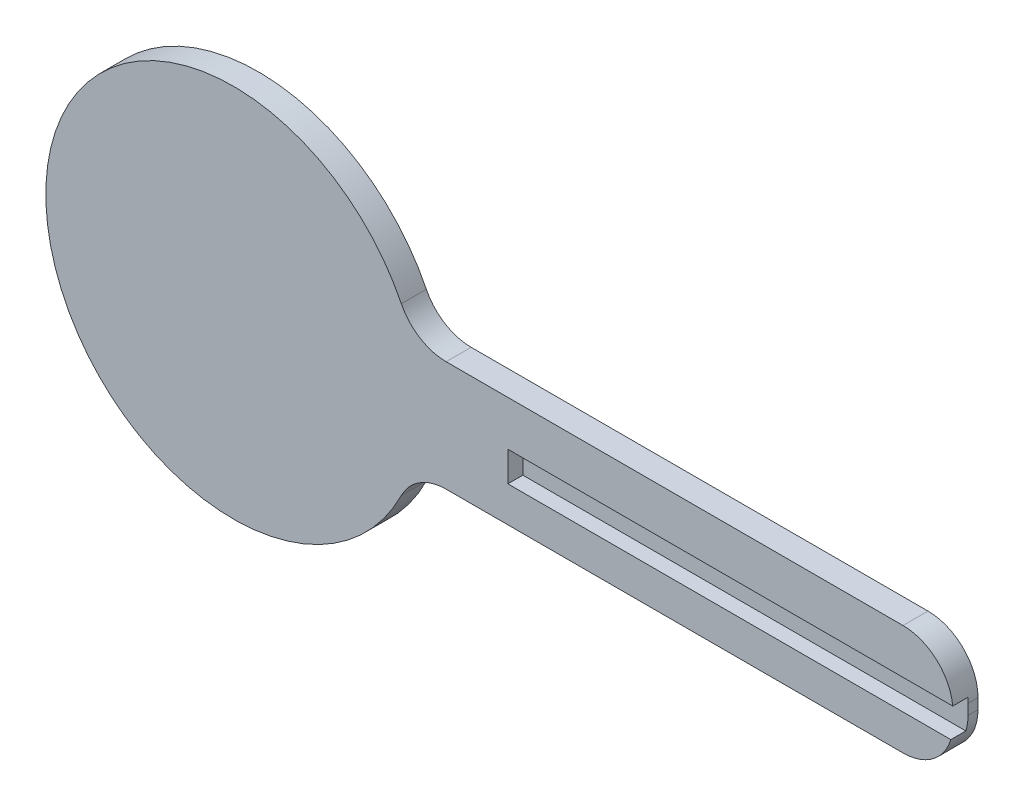
from build123d import *

# Parameters (mm, degrees)
BOSS_EXTRUDE1_DEPTH = 10
SKETCH2_W           = 168.929390661
SKETCH2_H           = 12
CUT_EXTRUDE1_DEPTH  = 6
SKETCH3_W           = 79.959911579
SKETCH3_H           = 12
CUT_EXTRUDE2_DEPTH  = 6


with BuildPart() as part:
    # Sketch1 → Boss-Extrude1 (new body)
    with BuildSketch(Plane.XY):
        with BuildLine():
            Line((85.170110947, 22.083871035), (267.939703111, 22.083871035))
            ThreePointArc((267.939703111, 22.083871035), (282.081838735, 16.226006659), (287.939703111, 2.083871035))
            Line((287.939703111, 2.083871035), (287.939703111, -2.083871035))
            ThreePointArc((287.939703111, -2.083871035), (282.081838735, -16.226006659), (267.939703111, -22.083871035))
            Line((267.939703111, -22.083871035), (85.170110947, -22.083871035))
            ThreePointArc((85.170110947, -22.083871035), (74.615378512, -25.095709768), (67.239561274, -33.224108712))
            ThreePointArc((67.239561274, -33.224108712), (-75, 0), (67.239561274, 33.224108712))
            ThreePointArc((67.239561274, 33.224108712), (74.615378512, 25.095709768), (85.170110947, 22.083871035))
        make_face()
    extrude(amount=BOSS_EXTRUDE1_DEPTH)

    # Sketch2 → Cut-Extrude1 (cut)
    with BuildSketch(Plane.XY.offset(10)):
        with Locations((194.3131347, -1.883371564)):
            Rectangle(SKETCH2_W, SKETCH2_H)
    extrude(amount=-CUT_EXTRUDE1_DEPTH, mode=Mode.SUBTRACT)

    # Sketch3 → Cut-Extrude2 (cut)
    with BuildSketch(Plane.XY.offset(10)):
        with Locations((318.757785819, -1.883371564)):
            Rectangle(SKETCH3_W, SKETCH3_H)
    extrude(amount=-CUT_EXTRUDE2_DEPTH, mode=Mode.SUBTRACT)


solid = part.part
